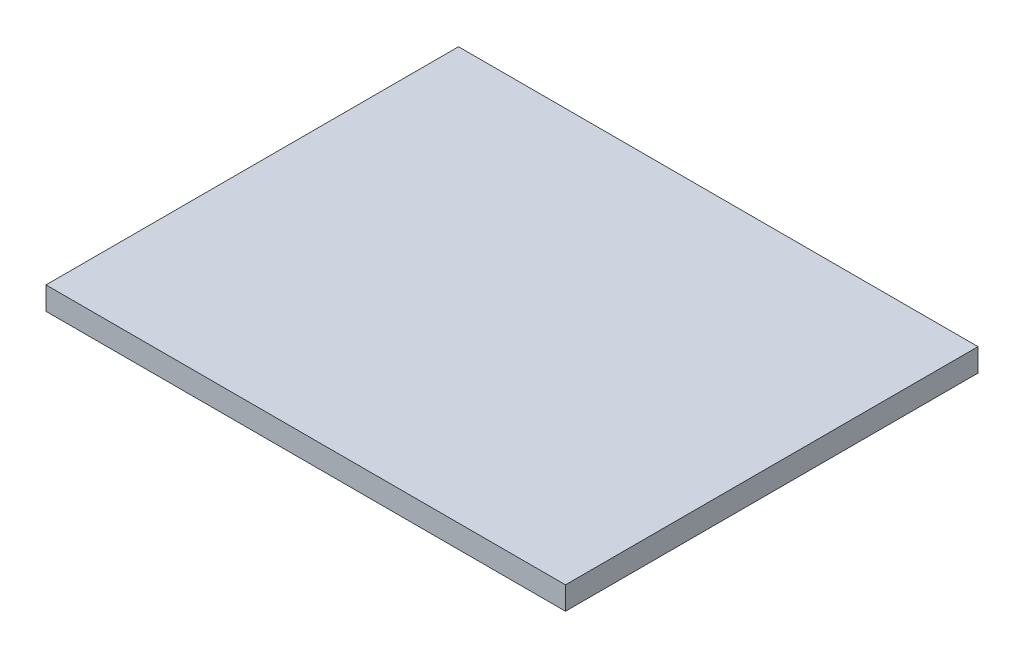
from build123d import *

# Parameters (mm, degrees)
SKETCH1_W           = 62
SKETCH1_H           = 48
BOSS_EXTRUDE1_DEPTH = 3


with BuildPart() as part:
    # Sketch1 → Boss-Extrude1 (new body)
    with BuildSketch(Plane(origin=(0, 0, 0), x_dir=(1, 0, 0), z_dir=(0, 1, 0))):
        Rectangle(SKETCH1_W, SKETCH1_H)
        Polygon((31, 24), (-31, 24), (-34, 27), (34, 27), align=None)
        Polygon((-31, -24), (-34, -27), (-34, 27), (-31, 24), align=None)
        Polygon((31, -24), (-31, -24), (-34, -27), (34, -27), align=None)
        Polygon((34, -27), (31, -24), (31, 24), (34, 27), align=None)
    extrude(amount=BOSS_EXTRUDE1_DEPTH)


solid = part.part
